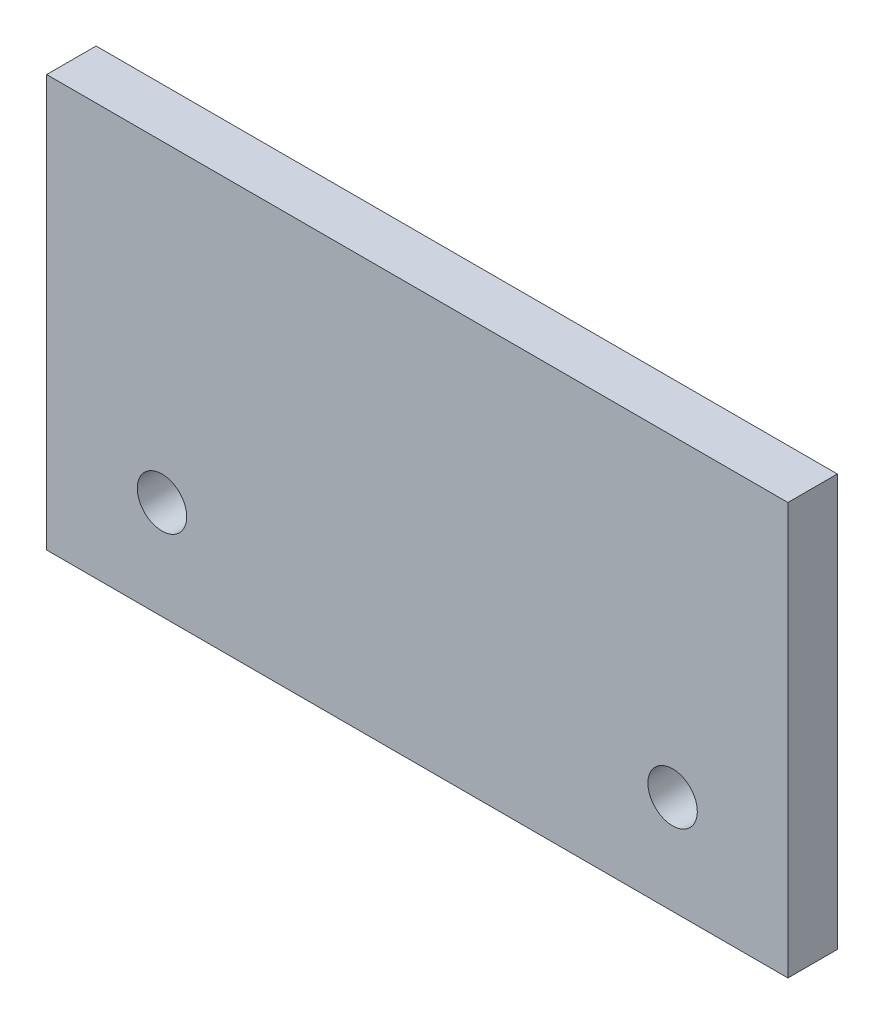
from build123d import *

# Parameters (mm, degrees)
CROQUIS1_W              = 45
CROQUIS1_H              = 25
CROQUIS1_R              = 1.5
SALIENTE_EXTRUIR1_DEPTH = 3


with BuildPart() as part:
    # Croquis1 → Saliente-Extruir1 (new body)
    with BuildSketch(Plane.XY):
        Rectangle(CROQUIS1_W, CROQUIS1_H)
        with Locations((15.5, -6.5)):
            Circle(CROQUIS1_R, mode=Mode.SUBTRACT)
        with Locations(Location((-15.5, -6.5, 0), (0, 0, 180))):
            Circle(CROQUIS1_R, mode=Mode.SUBTRACT)
    extrude(amount=SALIENTE_EXTRUIR1_DEPTH)


solid = part.part
